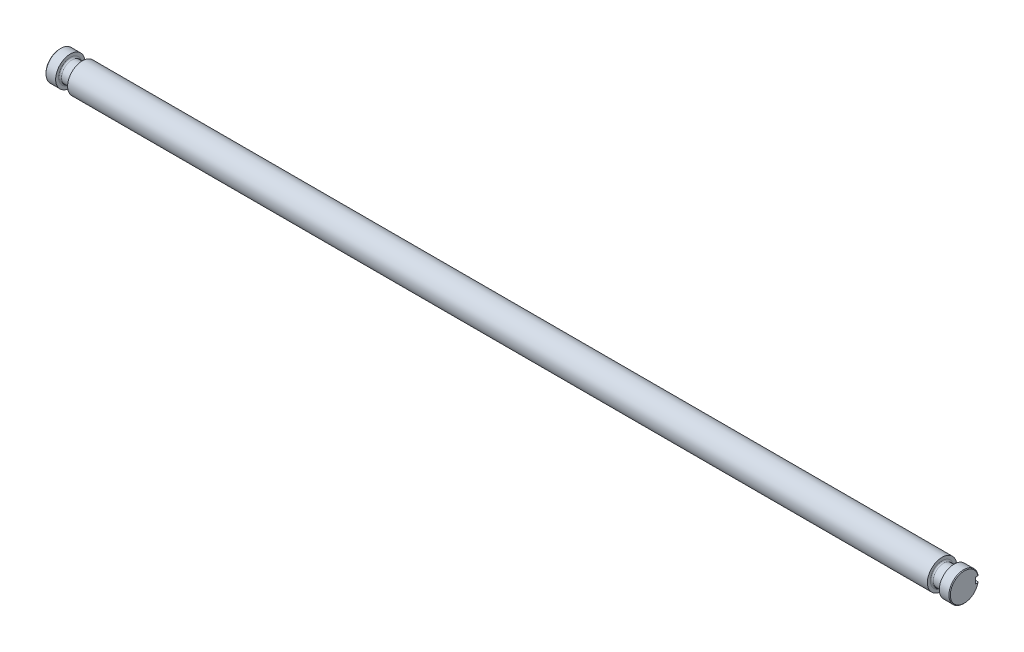
from build123d import *

# Parameters (mm, degrees)
CUT_EXTRUDE2_START = -998.728
SKETCH2_W          = 63.4619
SKETCH2_H          = 12.7
CUT_EXTRUDE2_DEPTH = 1997.456
FILLET1_R          = 3.175
CHAMFER1_SIZE      = 1.524


with BuildPart() as part:
    # Sketch1 → Revolve1 (revolve)
    with BuildSketch(Plane(origin=(0, 0, 0), x_dir=(1, 0, 0), z_dir=(0, 1, 0)), mode=Mode.PRIVATE) as revolve1_sk:
        Polygon((-976.376, 0), (-976.376, 31.73095), (-954.024, 31.73095), (-954.024, 22.0218), (-928.2176, 22.0218), (-928.2176, 31.73095), (928.3446, 31.73095), (928.3446, 22.0218), (954.151, 22.0218), (954.151, 31.73095), (976.376, 31.73095), (976.376, 0), align=None)
    revolve(revolve1_sk.sketch.rotate(Axis((-1001.776, 0, 0), (1, 0, 0)), 180), axis=Axis((-1001.776, 0, 0), (1, 0, 0)))

    # Sketch2 → Cut-Extrude2 (cut)
    with BuildSketch(Plane(origin=(0, 0, 0), x_dir=(0, 0, -1), z_dir=(1, 0, 0)).offset(CUT_EXTRUDE2_START)):
        with Locations((56.3372, 0)):
            Rectangle(SKETCH2_W, SKETCH2_H)
    extrude(amount=CUT_EXTRUDE2_DEPTH, mode=Mode.SUBTRACT)

    # Fillet1
    fillet1_edges = [part.edges().sort_by_distance(p)[0] for p in [
        (954.151, 0, -22.0218),
        (928.3446, 0, -22.0218),
        (-928.2176, 0, -22.0218),
        (-954.024, 0, -22.0218),
    ]]
    fillet(fillet1_edges, radius=FILLET1_R)

    # Chamfer1
    chamfer1_edges = [part.edges().sort_by_distance(p)[0] for p in [
        (976.376, 0, 31.73095),
        (-976.376, 0, 31.73095),
    ]]
    chamfer(chamfer1_edges, length=CHAMFER1_SIZE)


solid = part.part
